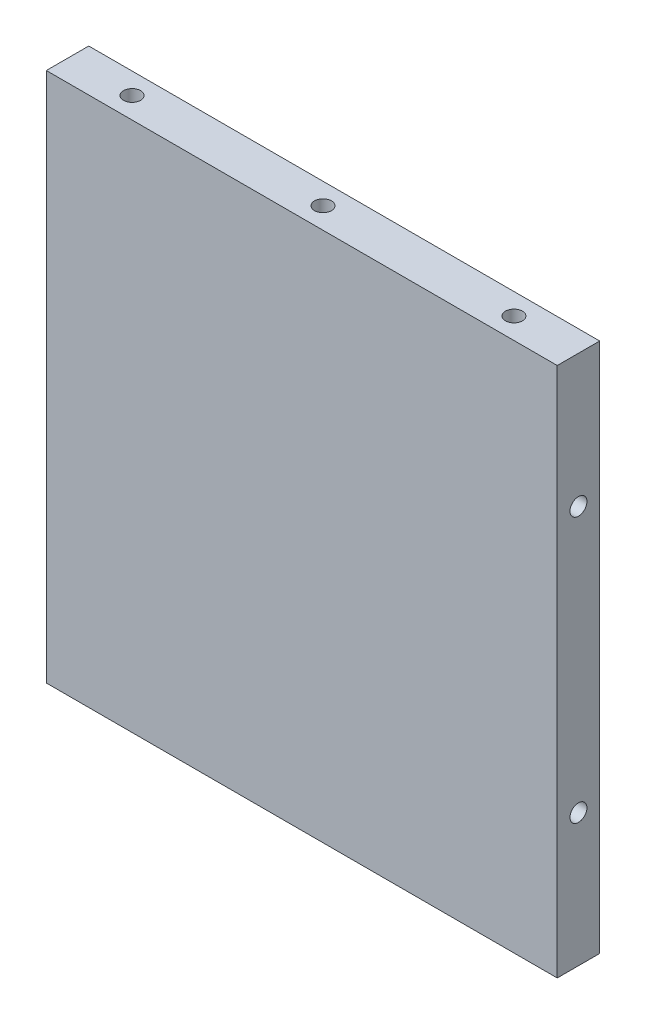
from build123d import *

# Parameters (mm, degrees)
SKETCH1_W                   = 120.4
SKETCH1_H                   = 10
DODANIE_WYCI_GNI_CIE1_DEPTH = 125
SZKIC1_R                    = 2
WYTNIJ_WYCI_GNI_CIE1_DEPTH  = 10
WYTNIJ_WYCI_GNI_CIE2_START  = -10
SZKIC2_R                    = 2
WYTNIJ_WYCI_GNI_CIE2_DEPTH  = 10
SZKIC3_R                    = 2
WYTNIJ_WYCI_GNI_CIE3_DEPTH  = 10
WYTNIJ_WYCI_GNI_CIE4_START  = -10
SZKIC4_R                    = 2
WYTNIJ_WYCI_GNI_CIE4_DEPTH  = 10


with BuildPart() as part:
    # Sketch1 → Dodanie-wyciągnięcie1 (new body)
    with BuildSketch(Plane(origin=(0, 0, 0), x_dir=(1, 0, 0), z_dir=(0, 1, 0))):
        with Locations((60.2, 5)):
            Rectangle(SKETCH1_W, SKETCH1_H)
    extrude(amount=DODANIE_WYCI_GNI_CIE1_DEPTH)

    # Szkic1 → Wytnij-wyciągnięcie1 (cut)
    with BuildSketch(Plane(origin=(0, 125, 0), x_dir=(1, 0, 0), z_dir=(0, 1, 0))):
        with Locations(Location((15.2, 5, 0), (0, 0, 270))):
            Circle(SZKIC1_R)
        with Locations(Location((60.2, 5, 0), (0, 0, 270))):
            Circle(SZKIC1_R)
        with Locations(Location((105.2, 5, 0), (0, 0, 270))):
            Circle(SZKIC1_R)
    extrude(amount=-WYTNIJ_WYCI_GNI_CIE1_DEPTH, mode=Mode.SUBTRACT)

    # Szkic2 → Wytnij-wyciągnięcie2 (cut)
    with BuildSketch(Plane.XZ.offset(WYTNIJ_WYCI_GNI_CIE2_START)):
        with Locations(Location((15.2, -5, 0), (0, 0, 90))):
            Circle(SZKIC2_R)
        with Locations(Location((60.2, -5, 0), (0, 0, 90))):
            Circle(SZKIC2_R)
        with Locations(Location((105.2, -5, 0), (0, 0, 90))):
            Circle(SZKIC2_R)
    extrude(amount=WYTNIJ_WYCI_GNI_CIE2_DEPTH, mode=Mode.SUBTRACT)

    # Szkic3 → Wytnij-wyciągnięcie3 (cut)
    with BuildSketch(Plane.ZY):
        with Locations((-5, 93.75)):
            Circle(SZKIC3_R)
        with Locations((-5, 31.25)):
            Circle(SZKIC3_R)
    extrude(amount=-WYTNIJ_WYCI_GNI_CIE3_DEPTH, mode=Mode.SUBTRACT)

    # Szkic4 → Wytnij-wyciągnięcie4 (cut)
    with BuildSketch(Plane(origin=(120.4, 0, 0), x_dir=(0, 0, -1), z_dir=(1, 0, 0)).offset(WYTNIJ_WYCI_GNI_CIE4_START)):
        with Locations(Location((5, 93.75, 0), (0, 0, 180))):
            Circle(SZKIC4_R)
        with Locations(Location((5, 31.25, 0), (0, 0, 180))):
            Circle(SZKIC4_R)
    extrude(amount=WYTNIJ_WYCI_GNI_CIE4_DEPTH, mode=Mode.SUBTRACT)


solid = part.part
